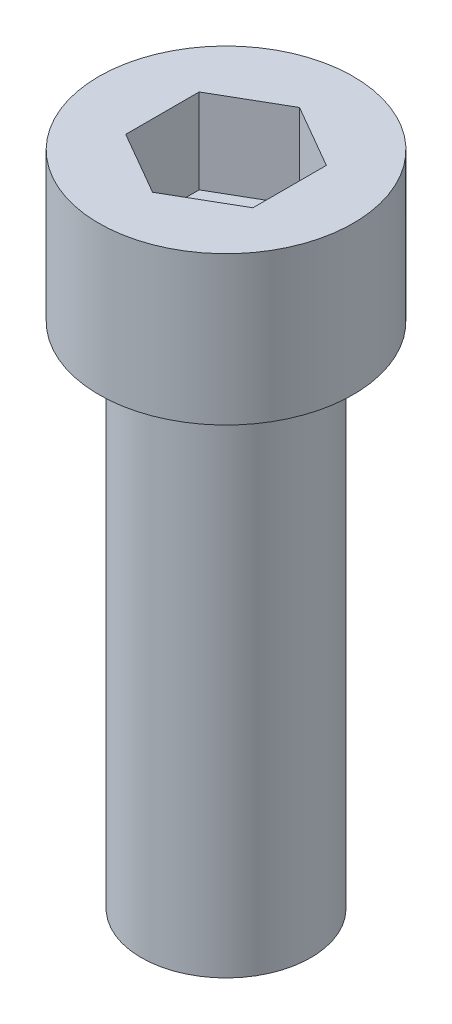
from build123d import *

# Parameters (mm, degrees)
CUT_EXTRUDE1_DEPTH = 2


with BuildPart() as part:
    # Sketch1 → Revolve1 (revolve)
    with BuildSketch(Plane.XY, mode=Mode.PRIVATE) as revolve1_sk:
        Polygon((0, 15.5), (0, 0), (2, 0), (2, 12), (3, 12), (3, 15.5), align=None)
    revolve(revolve1_sk.sketch.rotate(Axis((0, 15.5, 0), (0, -1, 0)), 180), axis=Axis((0, 15.5, 0), (0, -1, 0)))

    # Sketch2 → Cut-Extrude1 (cut)
    with BuildSketch(Plane(origin=(0, 15.5, 0), x_dir=(1, 0, 0), z_dir=(0, 1, 0))):
        Polygon((0, -1.732050808), (1.5, -0.866025404), (1.5, 0.866025404), (0, 1.732050808), (-1.5, 0.866025404), (-1.5, -0.866025404), align=None)
    extrude(amount=-CUT_EXTRUDE1_DEPTH, mode=Mode.SUBTRACT)


solid = part.part
